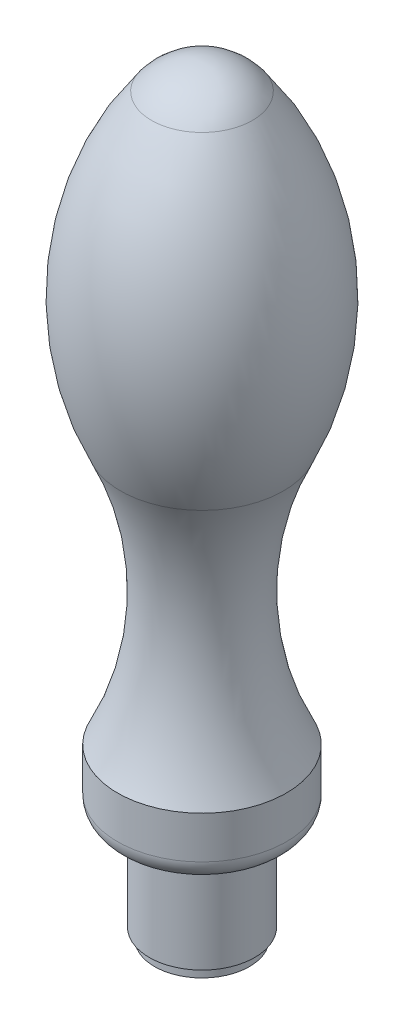
from build123d import *


with BuildPart() as part:
    # Sketch1 → Revolve1 (revolve)
    with BuildSketch(Plane.XY, mode=Mode.PRIVATE) as revolve1_sk:
        with BuildLine():
            Line((0, 0), (-4.5, 0))
            Line((-4.5, 0), (-4.5, 1))
            Line((-4.5, 1), (-5, 1))
            Line((-5, 1), (-5, 10))
            Line((-5, 10), (-6, 10))
            ThreePointArc((-6, 10), (-7.414213562, 10.585786438), (-8, 12))
            Line((-8, 12), (-8, 16))
            ThreePointArc((-8, 16), (-5, 28.303061069), (-7.726981853, 40.669502823))
            ThreePointArc((-7.726981853, 40.669502823), (-10.3121962, 55.557059673), (-4.784815021, 69.620158175))
            ThreePointArc((-4.784815021, 69.620158175), (-2.671989048, 71.372194573), (0, 72))
            Line((0, 72), (0, 0))
        make_face()
    revolve(revolve1_sk.sketch.rotate(Axis((0, 0, 0), (0, 1, 0)), 270), axis=Axis((0, 0, 0), (0, 1, 0)))


solid = part.part
